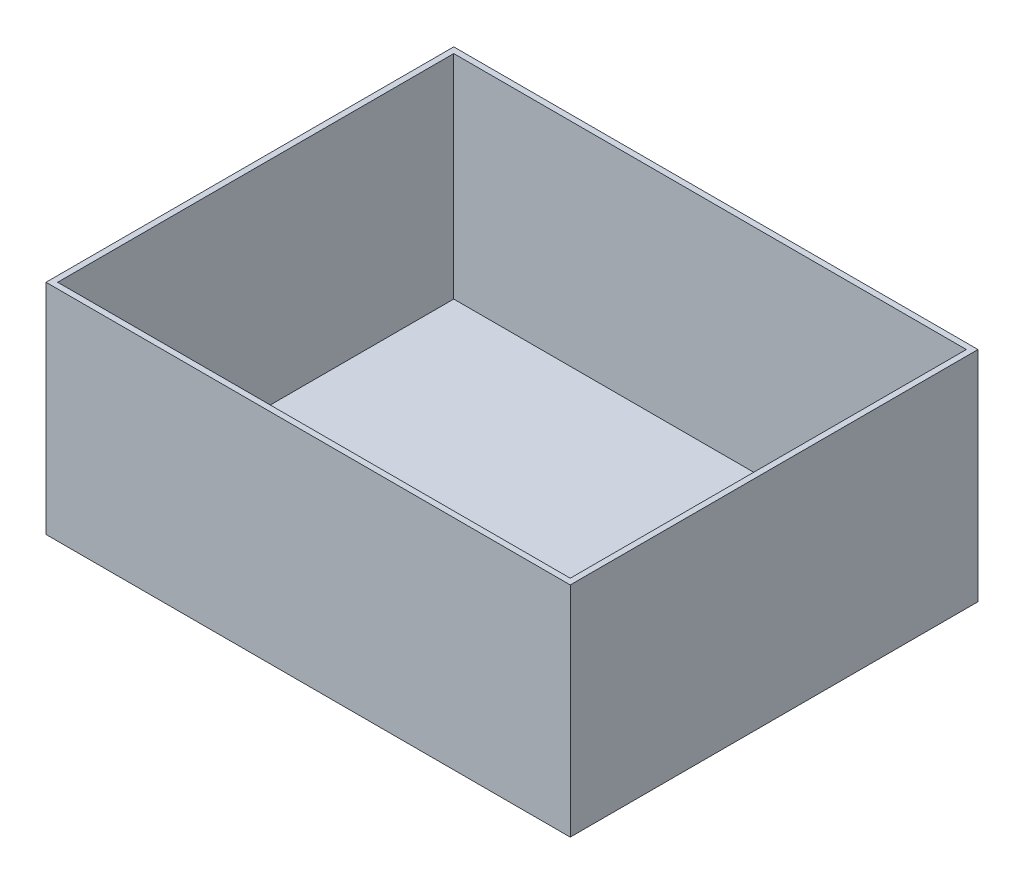
from build123d import *

# Parameters (mm, degrees)
SKETCH2_W           = 228.6
SKETCH2_H           = 177.8
BOSS_EXTRUDE1_DEPTH = 95.25
SHELL3_T            = -2.54


with BuildPart() as part:
    # Sketch2 → Boss-Extrude1 (new body)
    with BuildSketch(Plane(origin=(0, 0, 0), x_dir=(1, 0, 0), z_dir=(0, 1, 0))):
        Rectangle(SKETCH2_W, SKETCH2_H)
    extrude(amount=BOSS_EXTRUDE1_DEPTH)

    # Shell3
    shell3_openings = [part.faces().sort_by_distance(p)[0] for p in [
        (0, 95.25, 0),
    ]]
    offset(amount=SHELL3_T, openings=shell3_openings, kind=Kind.INTERSECTION)


solid = part.part
